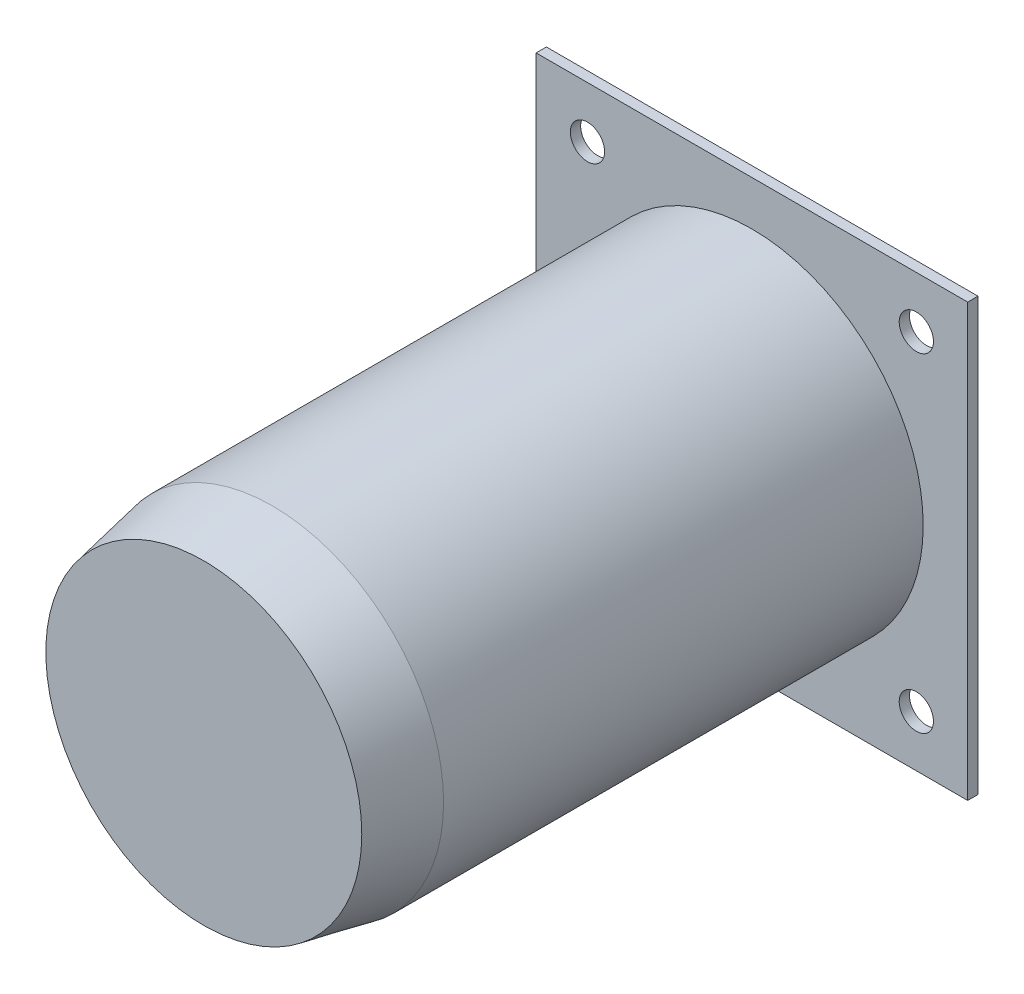
from build123d import *

# Parameters (mm, degrees)
SKETCH1_W           = 63
SKETCH1_H           = 63
SKETCH1_R           = 2.5
BOSS_EXTRUDE1_DEPTH = 1.5
SKETCH2_R           = 25
BOSS_EXTRUDE2_DEPTH = 80
CHAMFER1_SIZE       = 10
CHAMFER1_SIZE2      = 1.943803091


with BuildPart() as part:
    # Sketch1 → Boss-Extrude1 (new body)
    with BuildSketch(Plane.XY):
        Rectangle(SKETCH1_W, SKETCH1_H)
        with Locations((24, 24)):
            Circle(SKETCH1_R, mode=Mode.SUBTRACT)
        with Locations((24, -24)):
            Circle(SKETCH1_R, mode=Mode.SUBTRACT)
        with Locations((-24, -24)):
            Circle(SKETCH1_R, mode=Mode.SUBTRACT)
        with Locations((-24, 24)):
            Circle(SKETCH1_R, mode=Mode.SUBTRACT)
    extrude(amount=BOSS_EXTRUDE1_DEPTH)

    # Sketch2 → Boss-Extrude2 (add)
    with BuildSketch(Plane.XY.offset(1.5)):
        Circle(SKETCH2_R)
    extrude(amount=BOSS_EXTRUDE2_DEPTH)

    # Chamfer1
    chamfer1_edges = [part.edges().sort_by_distance(p)[0] for p in [
        (-25, 0, 81.5),
    ]]
    chamfer1_side = [part.faces().sort_by_distance(p)[0] for p in [
        (-25, 0, 41.5),
    ]]
    chamfer(chamfer1_edges, length=CHAMFER1_SIZE, length2=CHAMFER1_SIZE2, reference=chamfer1_side[0])


solid = part.part
